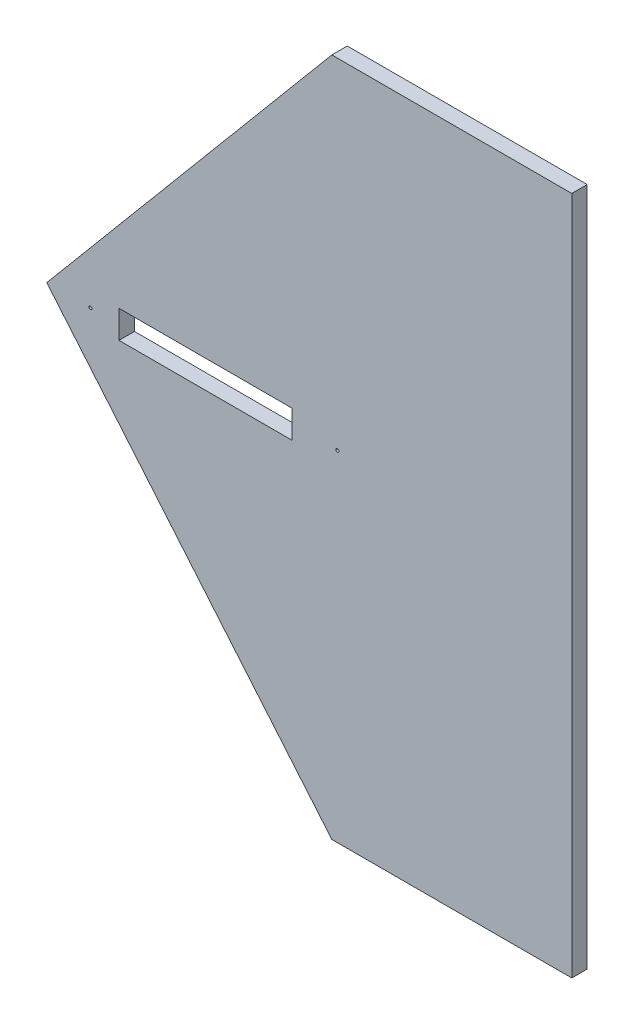
from build123d import *

# Parameters (mm, degrees)
BOSS_EXTRUDE1_DEPTH = 6.35
SKETCH4_W           = 71.12
SKETCH4_H           = 11.43
CUT_EXTRUDE1_DEPTH  = 258.233789577
SKETCH5_R           = 0.635
CUT_EXTRUDE2_DEPTH  = 258.233789577


with BuildPart() as part:
    # Sketch1 → Boss-Extrude1 (new body)
    with BuildSketch(Plane.XY):
        Polygon((215.9, 139.7), (215.9, -139.7), (117.222218475, -139.7), (0, 0), (117.222218475, 139.7), align=None)
    extrude(amount=BOSS_EXTRUDE1_DEPTH)

    # Sketch4 → Cut-Extrude1 (cut, through all)
    with BuildSketch(Plane.XY):
        with Locations((65.278, 0)):
            Rectangle(SKETCH4_W, SKETCH4_H)
    extrude(amount=CUT_EXTRUDE1_DEPTH, mode=Mode.SUBTRACT)

    # Sketch5 → Cut-Extrude2 (cut, through all)
    with BuildSketch(Plane.XY):
        with Locations((17.9578, 0)):
            Circle(SKETCH5_R)
        with Locations((119.5578, 0)):
            Circle(SKETCH5_R)
    extrude(amount=CUT_EXTRUDE2_DEPTH, mode=Mode.SUBTRACT)


solid = part.part
